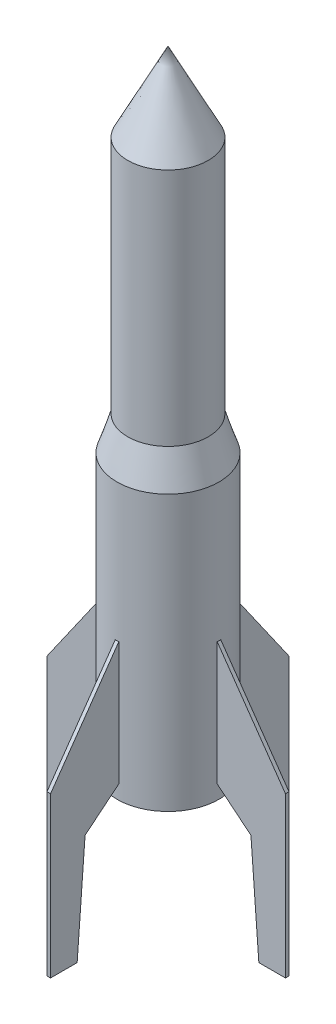
from build123d import *

# Parameters (mm, degrees)
CROQUIS1_R              = 57.5
SALIENTE_EXTRUIR1_DEPTH = 310
CROQUIS3_R              = 53.5
CORTAR_EXTRUIR1_DEPTH   = 310
CROQUIS5_R              = 45.431810566
SALIENTE_EXTRUIR2_DEPTH = 270
CROQUIS6_R              = 41.431810566
CORTAR_EXTRUIR2_DEPTH   = 270
CROQUIS8_W              = 4
CROQUIS8_H              = 290
SALIENTE_EXTRUIR3_DEPTH = 77
CORTAR_EXTRUIR3_DEPTH   = 77
MATRIZC3_COUNT          = 4


with BuildPart() as part:
    # Croquis1 → Saliente-Extruir1 (new body)
    with BuildSketch(Plane(origin=(0, 0, 0), x_dir=(1, 0, 0), z_dir=(0, 1, 0))):
        with Locations(Location((0, 0, 0), (0, 0, 270))):
            Circle(CROQUIS1_R)
    extrude(amount=SALIENTE_EXTRUIR1_DEPTH)

    # Croquis3 → Cortar-Extruir1 (cut)
    with BuildSketch(Plane.XZ):
        with Locations(Location((0, 0, 0), (0, 0, 270))):
            Circle(CROQUIS3_R)
    extrude(amount=-CORTAR_EXTRUIR1_DEPTH, mode=Mode.SUBTRACT)

    # Croquis4 → Revolución1 (revolve)
    with BuildSketch(Plane.XY, mode=Mode.PRIVATE) as revoluci_n1_sk:
        Polygon((53.5, 310), (57.5, 310), (45.431810566, 348.136056479), (41.431810566, 348.136056479), align=None)
    revolve(revoluci_n1_sk.sketch.rotate(Axis((0, 0, 0), (0, 1, 0)), 90), axis=Axis((0, 0, 0), (0, 1, 0)))

    # Croquis5 → Saliente-Extruir2 (add)
    with BuildSketch(Plane(origin=(0, 348.136056479, 0), x_dir=(1, 0, 0), z_dir=(0, 1, 0))):
        with Locations(Location((0, 0, 0), (0, 0, 270))):
            Circle(CROQUIS5_R)
    extrude(amount=SALIENTE_EXTRUIR2_DEPTH)

    # Croquis6 → Cortar-Extruir2 (cut)
    with BuildSketch(Plane(origin=(0, 618.136056479, 0), x_dir=(1, 0, 0), z_dir=(0, 1, 0))):
        with Locations(Location((0, 0, 0), (0, 0, 270))):
            Circle(CROQUIS6_R)
    extrude(amount=-CORTAR_EXTRUIR2_DEPTH, mode=Mode.SUBTRACT)

    # Croquis7 → Revolución2 (revolve)
    with BuildSketch(Plane.XY, mode=Mode.PRIVATE) as revoluci_n2_sk:
        Polygon((0, 707.220008955), (45.431810566, 618.136056479), (43.391855701, 618.136056479), (0, 703.220008955), align=None)
    revolve(revoluci_n2_sk.sketch.rotate(Axis((0, 0, 0), (0, 1, 0)), 90), axis=Axis((0, 0, 0), (0, 1, 0)))


with BuildPart() as body_2:
    # Croquis8 → Saliente-Extruir3 (new body)
    with BuildSketch(Plane(origin=(57.5, 0, 0), x_dir=(0, 0, -1), z_dir=(1, 0, 0))):
        with Locations((0, 10)):
            Rectangle(CROQUIS8_W, CROQUIS8_H)
    extrude(amount=SALIENTE_EXTRUIR3_DEPTH)

    # Croquis10 → Cortar-Extruir3 (cut)
    with BuildSketch(Plane(origin=(0, 0, -2), x_dir=(-1, 0, 0), z_dir=(0, 0, -1))):
        Polygon((-104.5, -135), (-95.519360765, -15), (-57.5, 16.115270239), (-57.5, -135), align=None)
        Polygon((-57.5, 155), (-134.5, 155), (-134.5, 45), align=None)
    extrude(amount=-CORTAR_EXTRUIR3_DEPTH, mode=Mode.SUBTRACT)


with BuildPart() as matrizc3_1:
    # MatrizC3: pattern copy
    add(body_2.part.rotate(Axis((0, 0, 0), (0, 1, 0)), 1 * 360 / MATRIZC3_COUNT))


with BuildPart() as matrizc3_2:
    # MatrizC3: pattern copy
    add(body_2.part.rotate(Axis((0, 0, 0), (0, 1, 0)), 2 * 360 / MATRIZC3_COUNT))


with BuildPart() as matrizc3_3:
    # MatrizC3: pattern copy
    add(body_2.part.rotate(Axis((0, 0, 0), (0, 1, 0)), 3 * 360 / MATRIZC3_COUNT))


solid = Compound([part.part, body_2.part, matrizc3_1.part, matrizc3_2.part, matrizc3_3.part])
